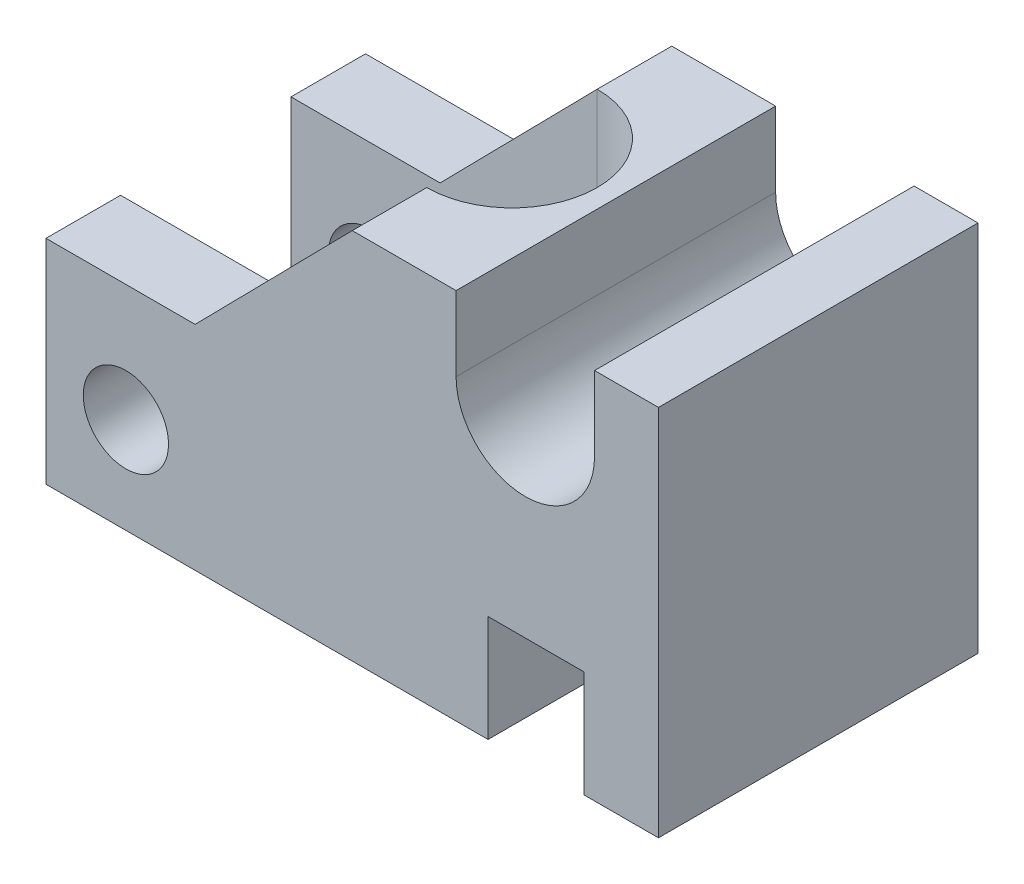
from build123d import *

# Parameters (mm, degrees)
SKETCH1_R           = 8
BOSS_EXTRUDE1_DEPTH = 60
CUT_EXTRUDE1_DEPTH  = 117.040965384


with BuildPart() as part:
    # Sketch1 → Boss-Extrude1 (new body)
    # profile 1 of 2: a face of its own
    with BuildSketch(Plane.XY):
        with BuildLine():
            Line((12.966344075, 70), (12.966344075, 0))
            Line((12.966344075, 0), (38.466344075, 0))
            Line((38.466344075, 0), (38.466344075, 20))
            Line((38.466344075, 20), (56.466344075, 20))
            Line((56.466344075, 20), (56.466344075, 0))
            Line((56.466344075, 0), (70.466344075, 0))
            Line((70.466344075, 0), (70.466344075, 70))
            Line((70.466344075, 70), (58.466344075, 70))
            Line((58.466344075, 70), (58.466344075, 56))
            ThreePointArc((58.466344075, 56), (45.466344075, 43), (32.466344075, 56))
            Line((32.466344075, 56), (32.466344075, 70))
            Line((32.466344075, 70), (12.966344075, 70))
        make_face()
    # profile 2 of 2: a face of its own
    with BuildSketch(Plane.XY):
        Polygon((-44.533655925, 0), (0, 0), (12.966344075, 0), (12.966344075, 70), (-16.533655925, 40), (-44.533655925, 40), align=None)
        with Locations((-29.533655925, 18)):
            Circle(SKETCH1_R, mode=Mode.SUBTRACT)
    extrude(amount=BOSS_EXTRUDE1_DEPTH)

    # Sketch2 → Cut-Extrude1 (cut, through all)
    with BuildSketch(Plane(origin=(0, 70, 0), x_dir=(1, 0, 0), z_dir=(0, 1, 0))):
        with BuildLine():
            Line((12.966344075, -14), (-56.308501396, -14))
            Line((-56.308501396, -14), (-56.308501396, -46))
            Line((-56.308501396, -46), (12.966344075, -46))
            ThreePointArc((12.966344075, -46), (28.966344075, -30), (12.966344075, -14))
        make_face()
    extrude(amount=-CUT_EXTRUDE1_DEPTH, mode=Mode.SUBTRACT)


solid = part.part
